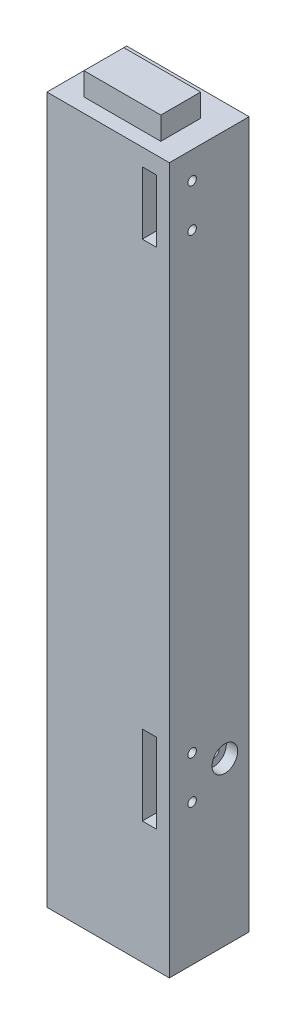
from build123d import *

# Parameters (mm, degrees)
SKETCH2_W           = 136.525
SKETCH2_H           = 787.4
BOSS_EXTRUDE1_DEPTH = 88.9
SKETCH4_W           = 85.725
SKETCH4_H           = 44.45
BOSS_EXTRUDE2_DEPTH = 25.4
SKETCH5_W           = 25.4
SKETCH5_H           = 82.55
CUT_EXTRUDE1_DEPTH  = 50.8
SKETCH6_W           = 15.875
SKETCH6_H           = 69.85
SKETCH6_H_2         = 88.9
CUT_EXTRUDE2_DEPTH  = 50.8
SKETCH7_R           = 4.7625
CUT_EXTRUDE3_DEPTH  = 44.45
SKETCH7_3_R         = 14.2875
CUT_EXTRUDE4_DEPTH  = 12.7
SKETCH7_4_R         = 6.35
CUT_EXTRUDE5_DEPTH  = 450.652194062


with BuildPart() as part:
    # Sketch2 → Boss-Extrude1 (new body)
    with BuildSketch(Plane.XY):
        Rectangle(SKETCH2_W, SKETCH2_H)
    extrude(amount=BOSS_EXTRUDE1_DEPTH)

    # Sketch4 → Boss-Extrude2 (add)
    with BuildSketch(Plane(origin=(0, 393.7, 0), x_dir=(1, 0, 0), z_dir=(0, 1, 0))):
        with Locations((0, -50.8)):
            Rectangle(SKETCH4_W, SKETCH4_H)
    extrude(amount=BOSS_EXTRUDE2_DEPTH)

    # Sketch5 → Cut-Extrude1 (cut)
    with BuildSketch(Plane.ZY.offset(68.2625)):
        with Locations((26.9875, -212.725)):
            Rectangle(SKETCH5_W, SKETCH5_H)
    extrude(amount=-CUT_EXTRUDE1_DEPTH, mode=Mode.SUBTRACT)

    # Sketch6 → Cut-Extrude2 (cut)
    with BuildSketch(Plane.XY.offset(88.9)):
        with Locations((46.0375, 339.725)):
            Rectangle(SKETCH6_W, SKETCH6_H)
        with Locations((46.0375, -212.725)):
            Rectangle(SKETCH6_W, SKETCH6_H_2)
    extrude(amount=-CUT_EXTRUDE2_DEPTH, mode=Mode.SUBTRACT)

    # Sketch7 → Cut-Extrude3 (cut)
    with BuildSketch(Plane(origin=(68.2625, 0, 0), x_dir=(0, 0, -1), z_dir=(1, 0, 0))):
        with Locations((-63.5, -188.9125)):
            Circle(SKETCH7_R)
        with Locations((-63.5, -236.5375)):
            Circle(SKETCH7_R)
        with Locations((-63.5, 315.9125)):
            Circle(SKETCH7_R)
        with Locations((-63.5, 363.5375)):
            Circle(SKETCH7_R)
    extrude(amount=-CUT_EXTRUDE3_DEPTH, mode=Mode.SUBTRACT)

    # Sketch7<3> → Cut-Extrude4 (cut)
    with BuildSketch(Plane(origin=(68.2625, 0, 0), x_dir=(0, 0, -1), z_dir=(1, 0, 0))):
        with Locations((-26.9875, -212.725)):
            Circle(SKETCH7_3_R)
    extrude(amount=-CUT_EXTRUDE4_DEPTH, mode=Mode.SUBTRACT)

    # Sketch7<4> → Cut-Extrude5 (cut, through all)
    with BuildSketch(Plane(origin=(68.2625, 0, 0), x_dir=(0, 0, -1), z_dir=(1, 0, 0))):
        with Locations((-26.9875, -212.725)):
            Circle(SKETCH7_4_R)
    extrude(amount=-CUT_EXTRUDE5_DEPTH, mode=Mode.SUBTRACT)


solid = part.part
